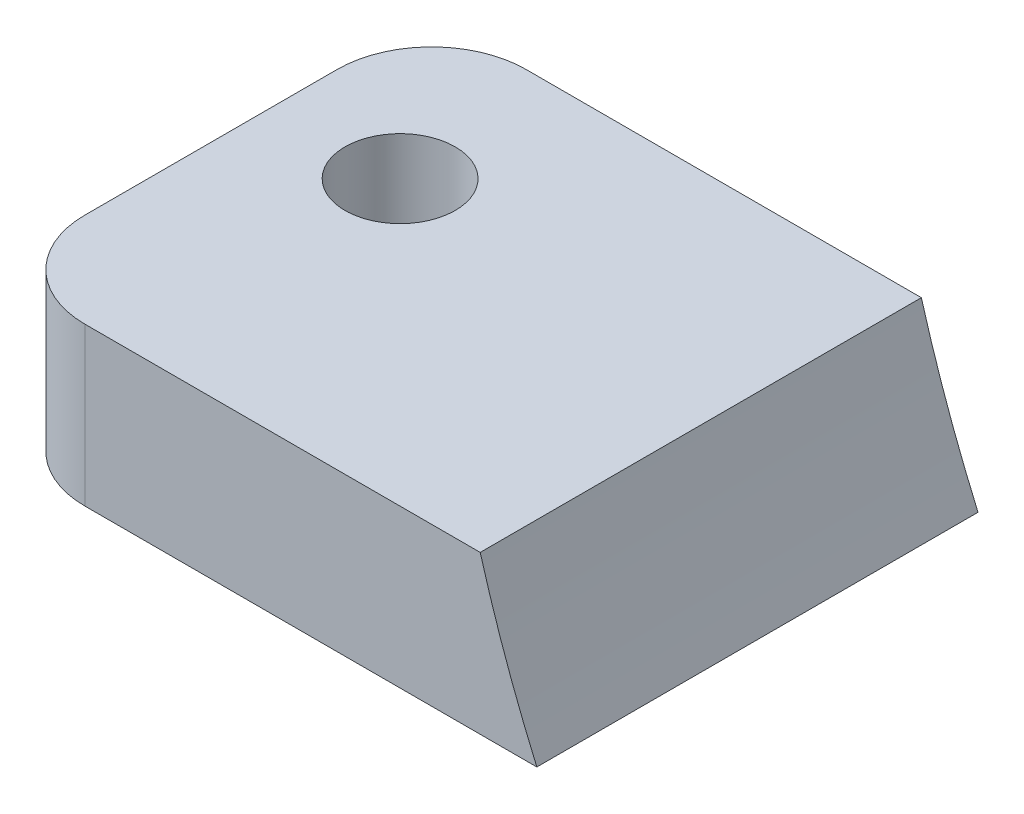
from build123d import *
from build123d.topology import SkipClean

# Parameters (mm, degrees)
SKETCH1_R                      = 40
SKETCH1_R_2                    = 38
BOSS_EXTRUDE1_DEPTH            = 200
SKETCH2_R                      = 40
BOSS_EXTRUDE2_DEPTH            = 2
BOSS_EXTRUDE3_DEPTH            = 107
BOSS_EXTRUDE4_DEPTH            = 2
SKETCH5_R                      = 1.75
CUT_EXTRUDE1_DEPTH             = 225.428162226
CUT_EXTRUDE2_REACH             = 218.296
SKETCH6_R                      = 4
CUT_EXTRUDE2_DIRECTION_2_REACH = 218.296
CIRPATTERN1_COUNT              = 2
CIRPATTERN1_ANGLE              = 90
BOSS_EXTRUDE5_REACH            = 241.742
BOSS_EXTRUDE5_END_RADIUS       = 40
SKETCH7_W                      = 14
SKETCH7_H                      = 5
CUT_EXTRUDE3_REACH             = 221.818
SKETCH8_R                      = 1.75
FILLET1_R                      = 3
CUT_EXTRUDE4_REACH             = 220.598
SKETCH9_R                      = 0.25
BOSS_EXTRUDE6_START            = 2
BOSS_EXTRUDE6_DEPTH            = 2
CUT_EXTRUDE5_REACH             = 220.147


with BuildPart() as part:
    # Sketch1 → Boss-Extrude1 (new body)
    with BuildSketch(Plane.XY):
        Circle(SKETCH1_R)
        Circle(SKETCH1_R_2, mode=Mode.SUBTRACT)
    extrude(amount=BOSS_EXTRUDE1_DEPTH)

    # Sketch2 → Boss-Extrude2 (add)
    with BuildSketch(Plane.XY.offset(180)):
        Circle(SKETCH2_R)
    extrude(amount=BOSS_EXTRUDE2_DEPTH)

    # Sketch3 → Boss-Extrude3 (add)
    with BuildSketch(Plane(origin=(0, 0, 0), x_dir=(-1, 0, 0), z_dir=(0, 0, -1))):
        with BuildLine():
            Line((-24, -32), (-72, -32))
            Line((-72, -32), (-72, -30))
            Line((-72, -30), (-26.457513111, -30))
            ThreePointArc((-26.457513111, -30), (-25.248567431, -31.024342744), (-24, -32))
        make_face()
        with BuildLine():
            Line((-24, 32), (-72, 32))
            Line((-72, 32), (-72, 30))
            Line((-72, 30), (-26.457513111, 30))
            ThreePointArc((-26.457513111, 30), (-25.248567431, 31.024342744), (-24, 32))
        make_face()
    extrude(amount=-BOSS_EXTRUDE3_DEPTH)

    # Sketch4 → Boss-Extrude4 (add)
    with BuildSketch(Plane.XY.offset(107)):
        with BuildLine():
            Line((72, -32), (24, -32))
            ThreePointArc((24, -32), (40, 0), (24, 32))
            Line((24, 32), (72, 32))
            Line((72, 32), (72, -32))
        make_face()
    extrude(amount=BOSS_EXTRUDE4_DEPTH)

    # Sketch5 → Cut-Extrude1 (cut, through all)
    with BuildSketch(Plane(origin=(0, 32, 0), x_dir=(1, 0, 0), z_dir=(0, 1, 0))):
        with Locations(Location((43.5, -102.5, 0), (0, 0, 270))):
            Circle(SKETCH5_R)
        with Locations(Location((43.5, -3.5, 0), (0, 0, 270))):
            Circle(SKETCH5_R)
        with Locations(Location((68.5, -78, 0), (0, 0, 270))):
            Circle(SKETCH5_R)
    extrude(amount=-CUT_EXTRUDE1_DEPTH, mode=Mode.SUBTRACT)

    # Sketch6 → Cut-Extrude2 (cut, up to next)
    with BuildSketch(Plane(origin=(0, 0, 0), x_dir=(0, 0, 1), z_dir=(-0.7071067811865488, 0.7071067811865464, 0)), mode=Mode.PRIVATE) as cut_extrude2_sk1:
        with Locations(Location((187, 0, 0), (0, 0, 90))):
            Circle(SKETCH6_R)
    cut_extrude2_tool1 = extrude(cut_extrude2_sk1.sketch, amount=-CUT_EXTRUDE2_REACH, mode=Mode.PRIVATE) & part.part
    cut_extrude2 = cut_extrude2_tool1.solids().sort_by_distance((0, 0, 187))[0]
    add(cut_extrude2, mode=Mode.SUBTRACT)

    # Sketch6 → Cut-Extrude2 direction 2 (cut, up to next)
    with BuildSketch(Plane(origin=(0, 0, 0), x_dir=(0, 0, 1), z_dir=(-0.7071067811865488, 0.7071067811865464, 0)), mode=Mode.PRIVATE) as cut_extrude2_direction_2_sk1:
        with Locations(Location((187, 0, 0), (0, 0, 90))):
            Circle(SKETCH6_R)
    cut_extrude2_direction_2_tool1 = extrude(cut_extrude2_direction_2_sk1.sketch, amount=CUT_EXTRUDE2_DIRECTION_2_REACH, mode=Mode.PRIVATE) & part.part
    cut_extrude2_direction_2 = cut_extrude2_direction_2_tool1.solids().sort_by_distance((0, 0, 187))[0]
    add(cut_extrude2_direction_2, mode=Mode.SUBTRACT)

    # CirPattern1: Cut-Extrude2, Cut-Extrude2 direction 2 ×2 about axis
    cirpattern1_axis = Axis((0, 0, -0.7), (0, 0, 1))
    add([cut_extrude2.rotate(cirpattern1_axis, i * CIRPATTERN1_ANGLE / (CIRPATTERN1_COUNT - 1)) for i in range(1, CIRPATTERN1_COUNT)], mode=Mode.SUBTRACT)
    add([cut_extrude2_direction_2.rotate(cirpattern1_axis, i * CIRPATTERN1_ANGLE / (CIRPATTERN1_COUNT - 1)) for i in range(1, CIRPATTERN1_COUNT)], mode=Mode.SUBTRACT)

    # Boss-Extrude5: up to this cylinder (the profile starts outside it)
    boss_extrude5_end = Plane(origin=(0, 0, 7), z_dir=(0, 0, -1)) * Cylinder(BOSS_EXTRUDE5_END_RADIUS, 564.484, mode=Mode.PRIVATE)
    # Sketch7 → Boss-Extrude5 (add, up to the surface)
    with BuildSketch(Plane(origin=(-54, 0, 0), x_dir=(0, 0, -1), z_dir=(1, 0, 0)), mode=Mode.PRIVATE) as boss_extrude5_sk1:
        with Locations((-7, -13.5)):
            Rectangle(SKETCH7_W, SKETCH7_H)
    boss_extrude5_tool1 = extrude(boss_extrude5_sk1.sketch, amount=BOSS_EXTRUDE5_REACH, mode=Mode.PRIVATE) - boss_extrude5_end
    add(boss_extrude5_tool1.solids().sort_by_distance((-54, -13.5, 7))[0])
    # Sketch7 → Boss-Extrude5 (add, up to the surface)
    with BuildSketch(Plane(origin=(-54, 0, 0), x_dir=(0, 0, -1), z_dir=(1, 0, 0)), mode=Mode.PRIVATE) as boss_extrude5_sk2:
        with Locations((-7, 13.5)):
            Rectangle(SKETCH7_W, SKETCH7_H)
    boss_extrude5_tool2 = extrude(boss_extrude5_sk2.sketch, amount=BOSS_EXTRUDE5_REACH, mode=Mode.PRIVATE) - boss_extrude5_end
    add(boss_extrude5_tool2.solids().sort_by_distance((-54, 13.5, 7))[0])

    # Cut-Extrude3: up to this face of the body (flat: up to its plane)
    cut_extrude3_end = Plane(part.part.faces().sort_by_distance((-45.33030278, 16, 7))[0])
    # Sketch8 → Cut-Extrude3 (cut, up to the picked face)
    with BuildSketch(Plane.XZ.offset(16), mode=Mode.PRIVATE) as cut_extrude3_sk1:
        with Locations(Location((-50, 5, 0), (0, 0, 270))):
            Circle(SKETCH8_R)
    cut_extrude3_tool1 = split(extrude(cut_extrude3_sk1.sketch, amount=-CUT_EXTRUDE3_REACH, mode=Mode.PRIVATE), bisect_by=cut_extrude3_end, keep=Keep.BOTH, mode=Mode.PRIVATE)
    add(cut_extrude3_tool1.solids().sort_by(Axis((-50, -16, 5), (0, 1, 0)))[0], mode=Mode.SUBTRACT)

    # Fillet1
    fillet1_edges = [part.edges().sort_by_distance(p)[0] for p in [
        (-54, -13.5, 14),
        (-54, -13.5, 0),
        (-54, 13.5, 0),
        (-54, 13.5, 14),
    ]]
    fillet(fillet1_edges, radius=FILLET1_R)

    # Sketch9 → Cut-Extrude4 (cut, up to next)
    with BuildSketch(Plane.XZ.offset(-11), mode=Mode.PRIVATE) as cut_extrude4_sk1:
        with Locations(Location((-44, 7, 0), (0, 0, 270))):
            Circle(SKETCH9_R)
    cut_extrude4_tool1 = extrude(cut_extrude4_sk1.sketch, amount=-CUT_EXTRUDE4_REACH, mode=Mode.PRIVATE) & part.part
    add(cut_extrude4_tool1.solids().sort_by_distance((-44, 11, 7))[0], mode=Mode.SUBTRACT)

    # Sketch10 → Boss-Extrude6 (add)
    with SkipClean():  # the faces are left unmerged after this step: merging them gives an invalid solid
        with BuildSketch(Plane(origin=(0, 0, 0), x_dir=(-1, 0, 0), z_dir=(0, 0, -1)).offset(BOSS_EXTRUDE6_START)):
            with BuildLine():
                ThreePointArc((10, -36.66060556), (0, -38), (-10, -36.66060556))
                Line((-10, -36.66060556), (-10, -38.729833462))
                ThreePointArc((-10, -38.729833462), (0, -40), (10, -38.729833462))
                Line((10, -38.729833462), (10, -36.66060556))
            make_face()
            with BuildLine():
                ThreePointArc((10, 38.729833462), (0, 40), (-10, 38.729833462))
                Line((-10, 38.729833462), (-10, 36.66060556))
                ThreePointArc((-10, 36.66060556), (0, 38), (10, 36.66060556))
                Line((10, 36.66060556), (10, 38.729833462))
            make_face()
        extrude(amount=-BOSS_EXTRUDE6_DEPTH)

    # Sketch11 → Cut-Extrude5 (cut, up to next)
    with BuildSketch(Plane.XY.offset(200), mode=Mode.PRIVATE) as cut_extrude5_sk1:
        with BuildLine():
            ThreePointArc((-39.953981252, 1.918171548), (-25.55703566, -30.770731683), (9.219033253, -38.923121996))
            ThreePointArc((9.219033253, -38.923121996), (103.998908328, 0), (9.219033253, 38.923121996))
            ThreePointArc((9.219033253, 38.923121996), (4.476281437, 39.748747207), (-0.331307503, 39.998627918))
            ThreePointArc((-0.331307503, 39.998627918), (-96.996927129, 100.925197981), (-39.953981252, 1.918171548))
        make_face()
    cut_extrude5_tool1 = extrude(cut_extrude5_sk1.sketch, amount=-CUT_EXTRUDE5_REACH, mode=Mode.PRIVATE) & part.part
    add(cut_extrude5_tool1.solids().sort_by_distance((-7.679141, 27.95673, 200))[0], mode=Mode.SUBTRACT)


solid = part.part
